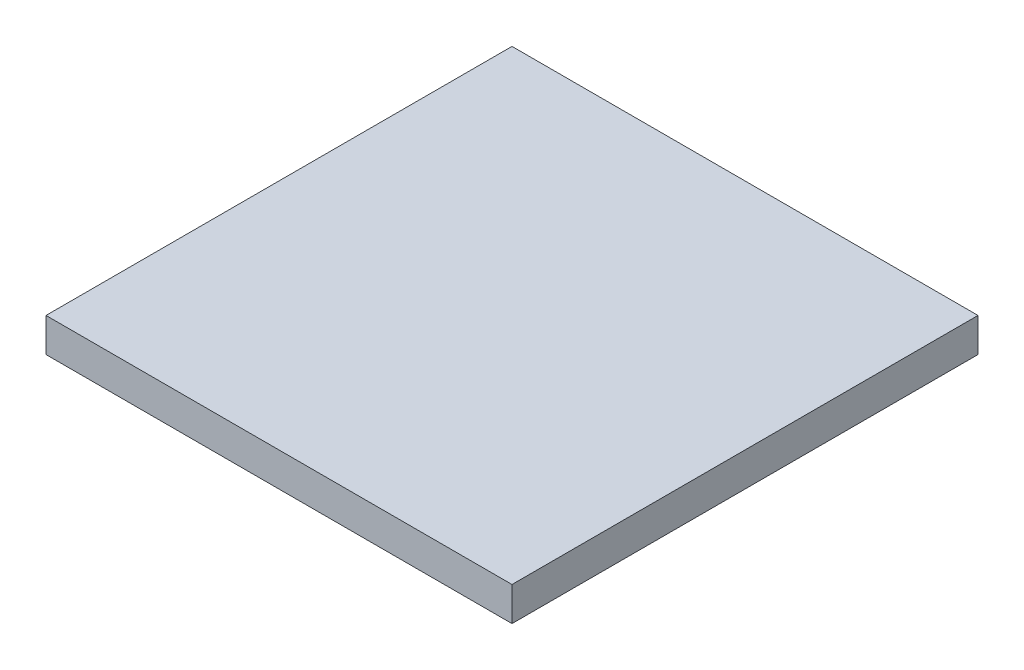
from build123d import *

# Parameters (mm, degrees)
SKETCH1_W           = 27.5
SKETCH1_H           = 27.5
BOSS_EXTRUDE1_DEPTH = 2


with BuildPart() as part:
    # Sketch1 → Boss-Extrude1 (new body)
    with BuildSketch(Plane(origin=(0, 0, 0), x_dir=(1, 0, 0), z_dir=(0, 1, 0))):
        Rectangle(SKETCH1_W, SKETCH1_H)
    extrude(amount=BOSS_EXTRUDE1_DEPTH)


solid = part.part
